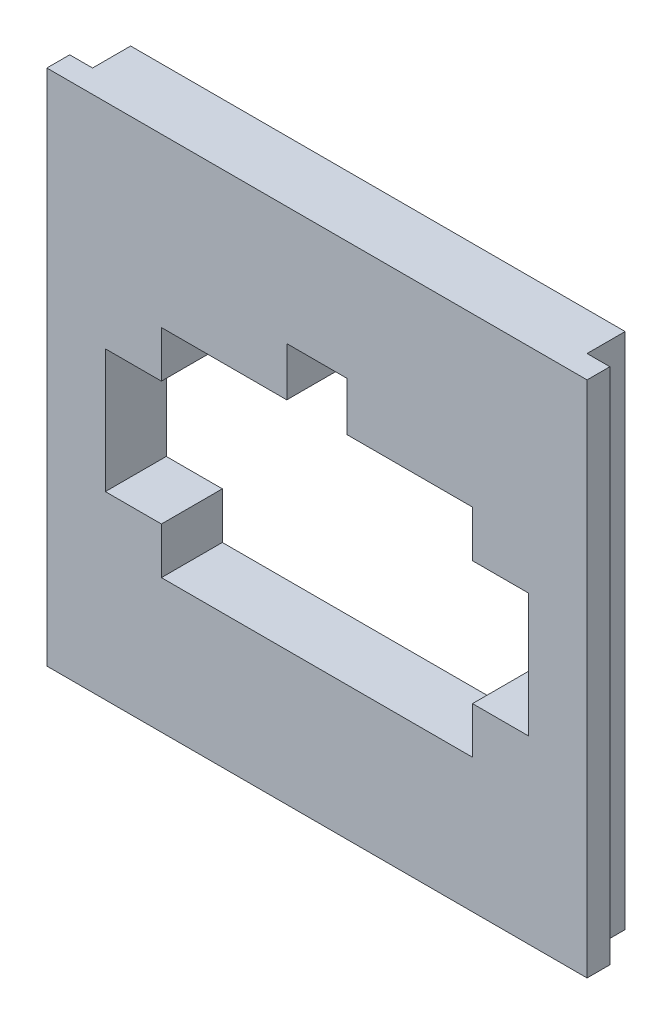
from build123d import *

# Parameters (mm, degrees)
SKETCH1_W           = 16.23
SKETCH1_H           = 17
BOSS_EXTRUDE1_DEPTH = 2
SKETCH2_W           = 0.749
SKETCH2_H           = 17
BOSS_EXTRUDE2_DEPTH = 0.75
SKETCH3_W           = 0.75
SKETCH3_H           = 17
BOSS_EXTRUDE4_DEPTH = 0.75
CUT_EXTRUDE1_DEPTH  = 16.776621323
CUT_EXTRUDE3_DEPTH  = 0.5


with BuildPart() as part:
    # Sketch1 → Boss-Extrude1 (new body)
    with BuildSketch(Plane.XY):
        with Locations((2.412127937, -2.350261097)):
            Rectangle(SKETCH1_W, SKETCH1_H)
    extrude(amount=BOSS_EXTRUDE1_DEPTH)

    # Sketch2 → Boss-Extrude2 (add)
    with BuildSketch(Plane(origin=(10.527127937, 0, 0), x_dir=(0, 0, -1), z_dir=(1, 0, 0))):
        with Locations((-1.6255, -2.350261097)):
            Rectangle(SKETCH2_W, SKETCH2_H)
    extrude(amount=BOSS_EXTRUDE2_DEPTH)

    # Sketch3 → Boss-Extrude4 (add)
    with BuildSketch(Plane.ZY.offset(5.702872063)):
        with Locations((1.625, -2.350261097)):
            Rectangle(SKETCH3_W, SKETCH3_H)
    extrude(amount=BOSS_EXTRUDE4_DEPTH)

    # Sketch4 → Cut-Extrude1 (cut, through all)
    with BuildSketch(Plane(origin=(0, 0, 0), x_dir=(-1, 0, 0), z_dir=(0, 0, -1))):
        Polygon((-7.517127937, 0.653975471), (-3.402127937, 0.653975471), (-3.402127937, 2.253975471), (-1.422127937, 2.253975471), (-1.422127937, 0.653975471), (2.692872063, 0.653975471), (2.692872063, -0.871024529), (4.532872063, -0.871024529), (4.532872063, -4.931024529), (2.692872063, -4.931024529), (2.692872063, -6.456024529), (-7.517127937, -6.456024529), (-7.517127937, -4.931024529), (-9.357127937, -4.931024529), (-9.357127937, -0.871024529), (-7.517127937, -0.871024529), align=None)
    extrude(amount=-CUT_EXTRUDE1_DEPTH, mode=Mode.SUBTRACT)

    # Sketch6 → Cut-Extrude3 (cut)
    with BuildSketch(Plane(origin=(0, 0, 0), x_dir=(-1, 0, 0), z_dir=(0, 0, -1))):
        with BuildLine():
            Line((-5.412127937, -10.850261097), (0.587872063, -10.850261097))
            ThreePointArc((0.587872063, -10.850261097), (-2.412127937, -7.850261097), (-5.412127937, -10.850261097))
        make_face()
    extrude(amount=-CUT_EXTRUDE3_DEPTH, mode=Mode.SUBTRACT)


solid = part.part
